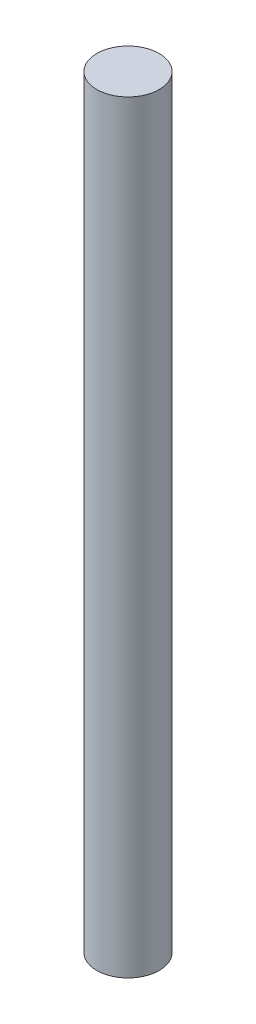
from build123d import *

# Parameters (mm, degrees)
SKETCH2_R = 6.75


with BuildPart() as part:
    # Sweep1: sweep along a path in Sketch1
    with BuildLine(Plane.XY) as sweep1_path:
        Line((0, 0), (0, 165))
    # Sketch2 → Sweep1 (sweep)
    with BuildSketch(Plane(origin=(0, 0, 0), x_dir=(1, 0, 0), z_dir=(0, 1, 0))):
        Circle(SKETCH2_R)
    sweep(path=sweep1_path.line)


solid = part.part
